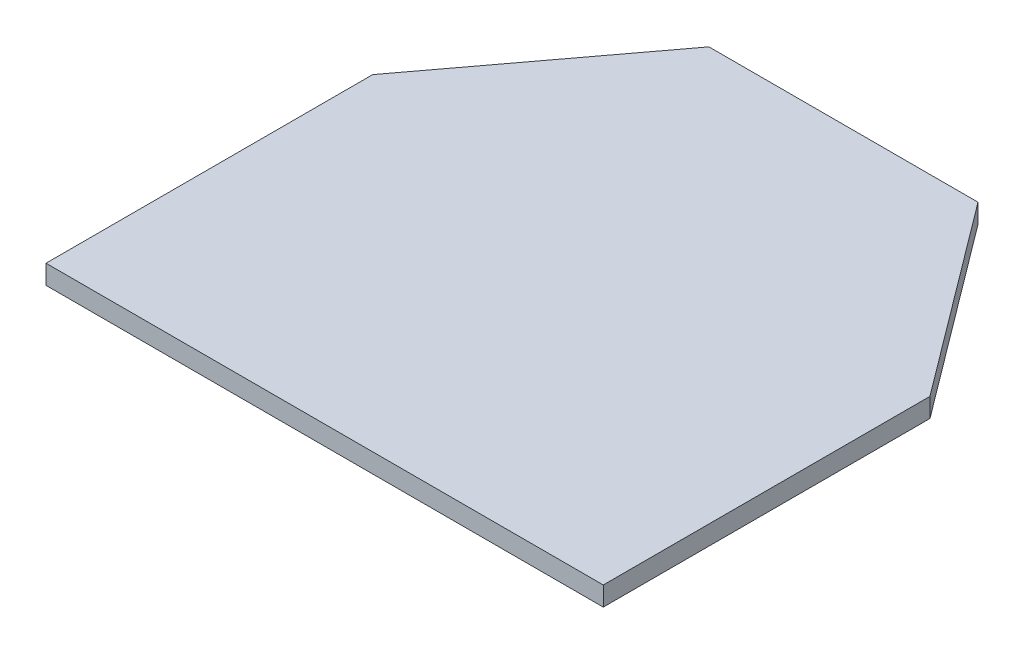
from build123d import *

# Parameters (mm, degrees)
BOSS_EXTRUDE1_DEPTH = 1


with BuildPart() as part:
    # Sketch2 → Boss-Extrude1 (new body)
    with BuildSketch(Plane(origin=(0, 0, 0), x_dir=(1, 0, 0), z_dir=(0, 1, 0))):
        Polygon((-15.689390537, -1.609535925), (-15.689390537, 15.390464075), (-8.189390537, 25.390464075), (5.810609463, 25.390464075), (13.310609463, 15.390464075), (13.310609463, -1.609535925), align=None)
    extrude(amount=BOSS_EXTRUDE1_DEPTH)


solid = part.part
